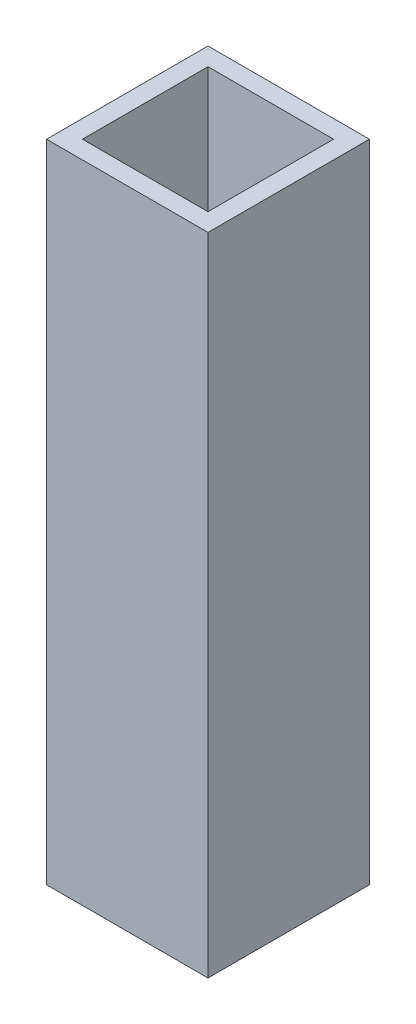
from build123d import *

# Parameters (mm, degrees)
SKETCH_1_W      = 4.5
SKETCH_1_H      = 4.5
SKETCH_1_W_2    = 3.5
SKETCH_1_H_2    = 3.5
EXTRUDE_1_DEPTH = 18


with BuildPart() as part:
    # 草图1 → 凸台-拉伸1 (new body)
    with BuildSketch(Plane(origin=(0, 0, 0), x_dir=(1, 0, 0), z_dir=(0, 1, 0))):
        Rectangle(SKETCH_1_W, SKETCH_1_H)
        Rectangle(SKETCH_1_W_2, SKETCH_1_H_2, mode=Mode.SUBTRACT)
    extrude(amount=EXTRUDE_1_DEPTH)


solid = part.part
